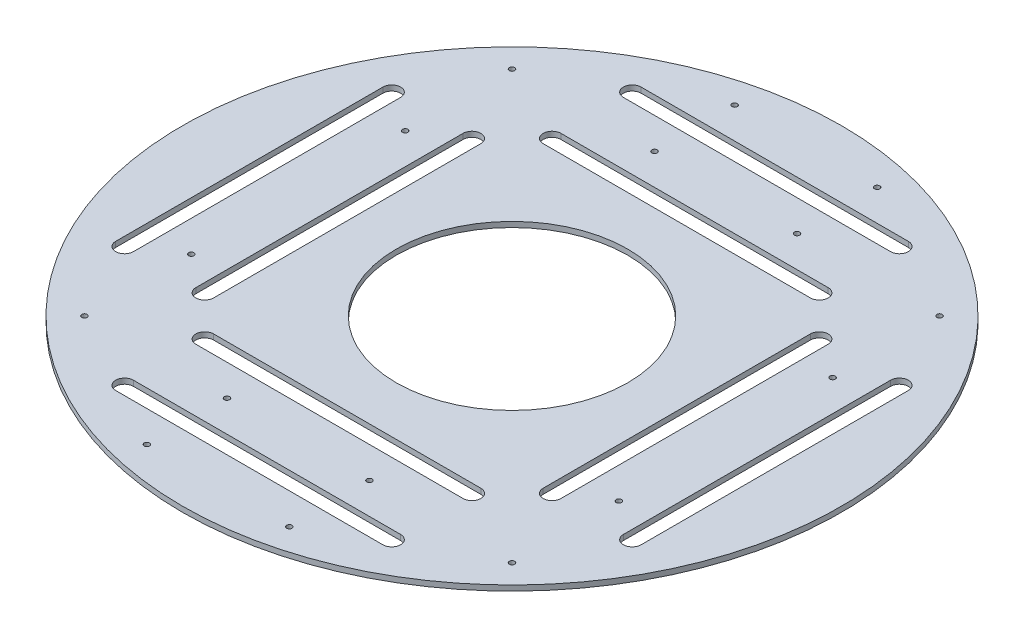
from build123d import *

# Parameters (mm, degrees)
SKETCH_1_R      = 185
SKETCH_1_R_2    = 1.5
SKETCH_1_R_3    = 65
EXTRUDE_1_DEPTH = 3


with BuildPart() as part:
    # 草图1 → 凸台-拉伸1 (new body)
    with BuildSketch(Plane(origin=(0, 0, 0), x_dir=(1, 0, 0), z_dir=(0, 1, 0))):
        with Locations(Location((0, 0, 0), (0, 0, 270))):
            Circle(SKETCH_1_R)
        with Locations(Location((120, 120, 0), (0, 0, 270))):
            Circle(SKETCH_1_R_2, mode=Mode.SUBTRACT)
        with Locations(Location((-120, 120, 0), (0, 0, 270))):
            Circle(SKETCH_1_R_2, mode=Mode.SUBTRACT)
        with Locations(Location((-120, -120, 0), (0, 0, 270))):
            Circle(SKETCH_1_R_2, mode=Mode.SUBTRACT)
        with Locations(Location((120, -120, 0), (0, 0, 270))):
            Circle(SKETCH_1_R_2, mode=Mode.SUBTRACT)
        with Locations(Location((0, 0, 0), (0, 0, 270))):
            Circle(SKETCH_1_R_3, mode=Mode.SUBTRACT)
        with Locations(Location((40, 165, 0), (0, 0, 270))):
            Circle(SKETCH_1_R_2, mode=Mode.SUBTRACT)
        with Locations(Location((40, 120, 0), (0, 0, 270))):
            Circle(SKETCH_1_R_2, mode=Mode.SUBTRACT)
        with Locations(Location((-40, 120, 0), (0, 0, 270))):
            Circle(SKETCH_1_R_2, mode=Mode.SUBTRACT)
        with Locations(Location((-40, 165, 0), (0, 0, 270))):
            Circle(SKETCH_1_R_2, mode=Mode.SUBTRACT)
        with Locations(Location((-40, -165, 0), (0, 0, 270))):
            Circle(SKETCH_1_R_2, mode=Mode.SUBTRACT)
        with Locations(Location((-40, -120, 0), (0, 0, 270))):
            Circle(SKETCH_1_R_2, mode=Mode.SUBTRACT)
        with Locations(Location((40, -120, 0), (0, 0, 270))):
            Circle(SKETCH_1_R_2, mode=Mode.SUBTRACT)
        with Locations(Location((40, -165, 0), (0, 0, 270))):
            Circle(SKETCH_1_R_2, mode=Mode.SUBTRACT)
        with Locations(Location((120, 60, 0), (0, 0, 270))):
            Circle(SKETCH_1_R_2, mode=Mode.SUBTRACT)
        with Locations(Location((120, -60, 0), (0, 0, 270))):
            Circle(SKETCH_1_R_2, mode=Mode.SUBTRACT)
        with Locations(Location((-120, -60, 0), (0, 0, 270))):
            Circle(SKETCH_1_R_2, mode=Mode.SUBTRACT)
        with Locations(Location((-120, 60, 0), (0, 0, 270))):
            Circle(SKETCH_1_R_2, mode=Mode.SUBTRACT)
        with BuildLine():
            Line((-137.5, -75), (-137.5, 75))
            ThreePointArc((-137.5, 75), (-142.5, 80), (-147.5, 75))
            Line((-147.5, 75), (-147.5, -75))
            ThreePointArc((-147.5, -75), (-142.5, -80), (-137.5, -75))
        make_face(mode=Mode.SUBTRACT)
        with BuildLine():
            Line((-102.5, -75), (-102.5, 75))
            ThreePointArc((-102.5, 75), (-97.5, 80), (-92.5, 75))
            Line((-92.5, 75), (-92.5, -75))
            ThreePointArc((-92.5, -75), (-97.5, -80), (-102.5, -75))
        make_face(mode=Mode.SUBTRACT)
        with BuildLine():
            Line((-75, -102.5), (75, -102.5))
            ThreePointArc((75, -102.5), (80, -97.5), (75, -92.5))
            Line((75, -92.5), (-75, -92.5))
            ThreePointArc((-75, -92.5), (-80, -97.5), (-75, -102.5))
        make_face(mode=Mode.SUBTRACT)
        with BuildLine():
            Line((-75, -137.5), (75, -137.5))
            ThreePointArc((75, -137.5), (80, -142.5), (75, -147.5))
            Line((75, -147.5), (-75, -147.5))
            ThreePointArc((-75, -147.5), (-80, -142.5), (-75, -137.5))
        make_face(mode=Mode.SUBTRACT)
        with BuildLine():
            Line((137.5, -75), (137.5, 75))
            ThreePointArc((137.5, 75), (142.5, 80), (147.5, 75))
            Line((147.5, 75), (147.5, -75))
            ThreePointArc((147.5, -75), (142.5, -80), (137.5, -75))
        make_face(mode=Mode.SUBTRACT)
        with BuildLine():
            Line((102.5, -75), (102.5, 75))
            ThreePointArc((102.5, 75), (97.5, 80), (92.5, 75))
            Line((92.5, 75), (92.5, -75))
            ThreePointArc((92.5, -75), (97.5, -80), (102.5, -75))
        make_face(mode=Mode.SUBTRACT)
        with BuildLine():
            Line((-75, 102.5), (75, 102.5))
            ThreePointArc((75, 102.5), (80, 97.5), (75, 92.5))
            Line((75, 92.5), (-75, 92.5))
            ThreePointArc((-75, 92.5), (-80, 97.5), (-75, 102.5))
        make_face(mode=Mode.SUBTRACT)
        with BuildLine():
            Line((-75, 137.5), (75, 137.5))
            ThreePointArc((75, 137.5), (80, 142.5), (75, 147.5))
            Line((75, 147.5), (-75, 147.5))
            ThreePointArc((-75, 147.5), (-80, 142.5), (-75, 137.5))
        make_face(mode=Mode.SUBTRACT)
    extrude(amount=EXTRUDE_1_DEPTH)


solid = part.part
